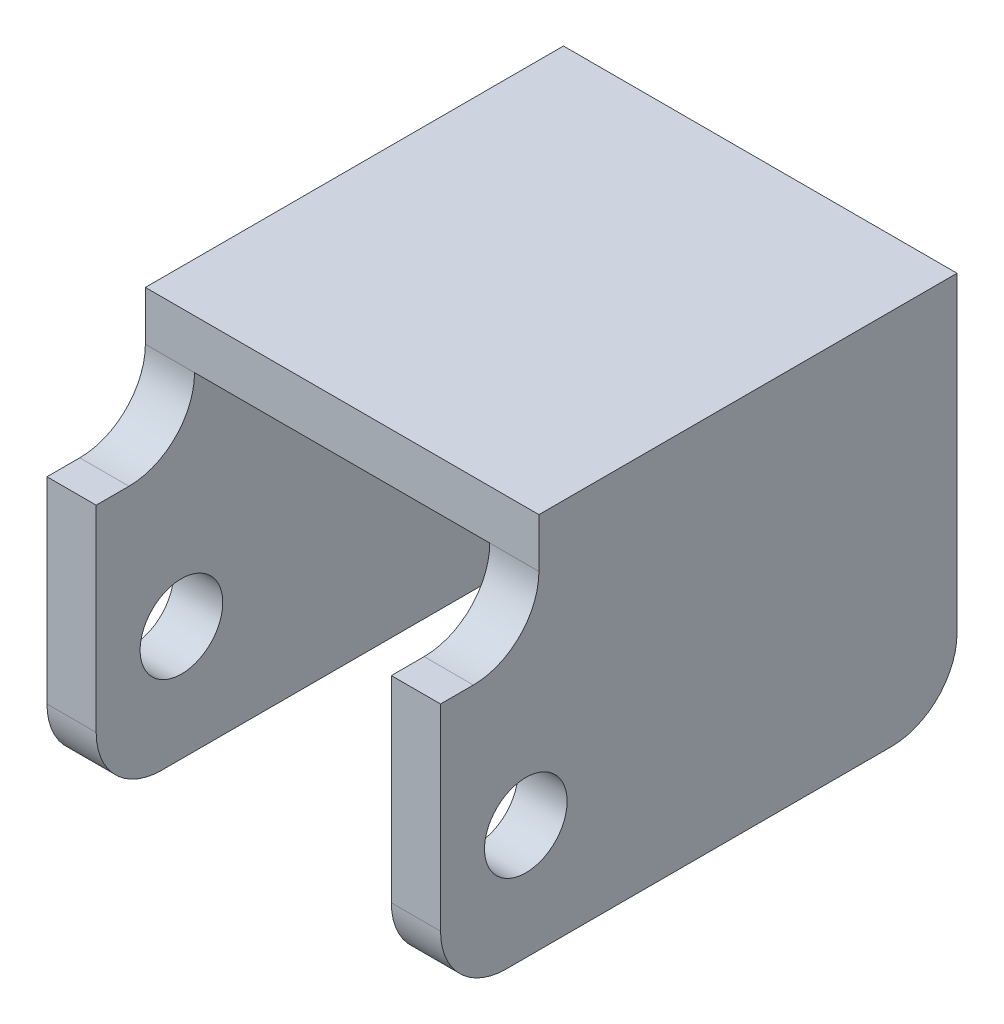
from build123d import *

# Parameters (mm, degrees)
SKETCH1_W           = 4.7625
SKETCH1_H           = 50
SKETCH1_W_2         = 28.575
BOSS_EXTRUDE1_DEPTH = 4.7625
SKETCH1_3_W         = 4.7625
SKETCH1_3_H         = 50
BOSS_EXTRUDE2_DEPTH = 31.75
SKETCH3_W           = 9.525
SKETCH3_H           = 11.1125
SKETCH3_R           = 4
CUT_EXTRUDE1_DEPTH  = 56.539828052
FILLET1_R           = 6.35


with BuildPart() as part:
    # Sketch1 → Boss-Extrude1 (new body)
    with BuildSketch(Plane(origin=(0, 0, 0), x_dir=(1, 0, 0), z_dir=(0, 1, 0))):
        with Locations((-16.66875, 0)):
            Rectangle(SKETCH1_W, SKETCH1_H)
        Rectangle(SKETCH1_W_2, SKETCH1_H)
        with Locations((16.66875, 0)):
            Rectangle(SKETCH1_W, SKETCH1_H)
    extrude(amount=BOSS_EXTRUDE1_DEPTH)

    # Sketch1<3> → Boss-Extrude2 (add)
    with BuildSketch(Plane(origin=(0, 0, 0), x_dir=(1, 0, 0), z_dir=(0, 1, 0))):
        with Locations((-16.66875, 0)):
            Rectangle(SKETCH1_3_W, SKETCH1_3_H)
        with Locations((16.66875, 0)):
            Rectangle(SKETCH1_3_W, SKETCH1_3_H)
    extrude(amount=-BOSS_EXTRUDE2_DEPTH)

    # Sketch3 → Cut-Extrude1 (cut, through all)
    with BuildSketch(Plane(origin=(19.05, 0, 0), x_dir=(0, 0, -1), z_dir=(1, 0, 0))):
        with Locations((-20.2375, -0.79375)):
            Rectangle(SKETCH3_W, SKETCH3_H)
        with Locations((-16.745, -20.6375)):
            Circle(SKETCH3_R)
    extrude(amount=-CUT_EXTRUDE1_DEPTH, mode=Mode.SUBTRACT)

    # Fillet1
    fillet1_edges = [part.edges().sort_by_distance(p)[0] for p in [
        (-16.66875, -31.75, 25),
        (16.66875, -31.75, 25),
        (-16.66875, -31.75, -25),
        (16.66875, -31.75, -25),
        (-16.66875, -6.35, 15.475),
        (16.66875, -6.35, 15.475),
    ]]
    fillet(fillet1_edges, radius=FILLET1_R)


solid = part.part
